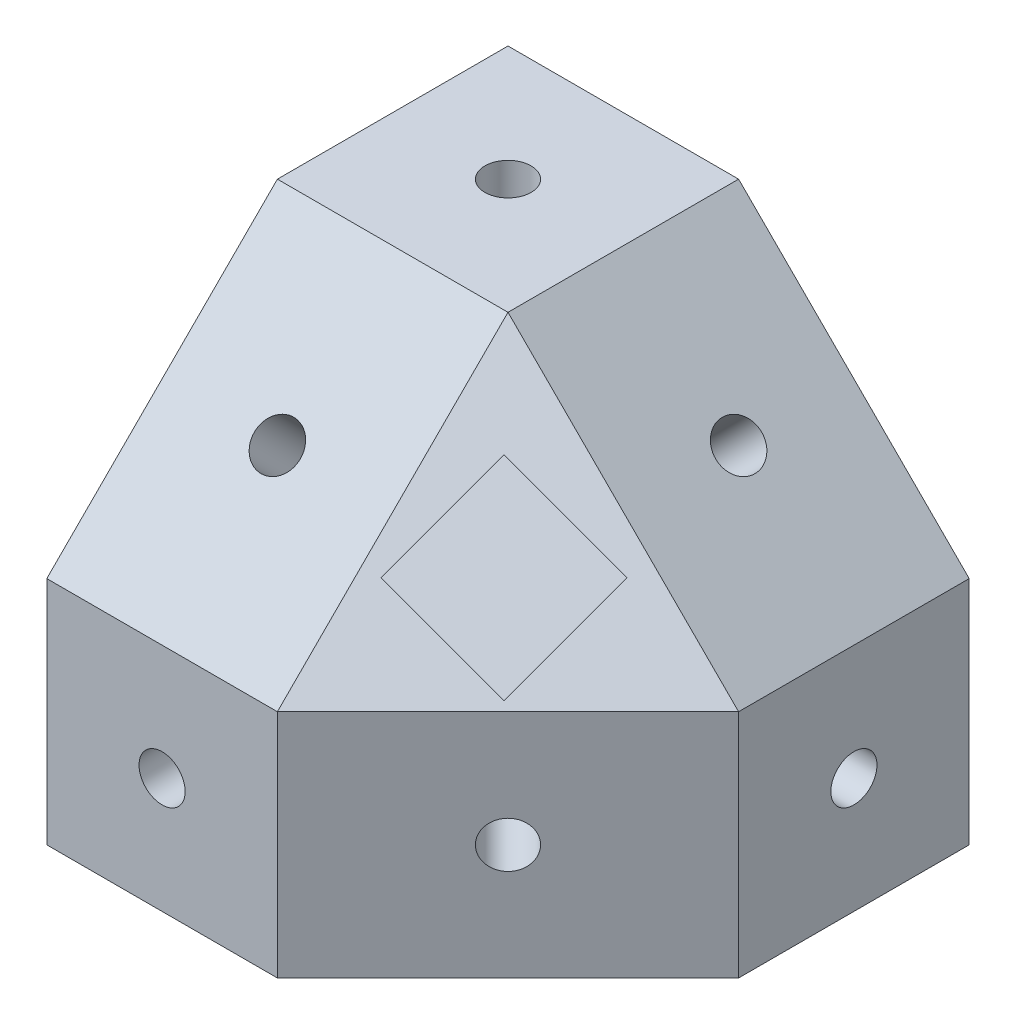
from build123d import *

# Parameters (mm, degrees)
SKETCH1_W           = 30
SKETCH1_H           = 30
BOSS_EXTRUDE1_DEPTH = 30
CUT_EXTRUDE1_DEPTH  = 30
CUT_EXTRUDE2_DEPTH  = 30
CUT_EXTRUDE3_DEPTH  = 30
CUT_EXTRUDE4_DEPTH  = 30
CUT_EXTRUDE5_DEPTH  = 15
SKETCH6_R           = 1.5
CUT_EXTRUDE6_DEPTH  = 10
SKETCH7_R           = 1.5
CUT_EXTRUDE7_DEPTH  = 10
SKETCH8_R           = 1.5
CUT_EXTRUDE8_DEPTH  = 10
SKETCH9_R           = 1.5
CUT_EXTRUDE9_DEPTH  = 10
SKETCH10_R          = 1.5
CUT_EXTRUDE10_DEPTH = 10
SKETCH11_R          = 1.5
CUT_EXTRUDE11_DEPTH = 10


with BuildPart() as part:
    # Sketch1 → Boss-Extrude1 (new body)
    with BuildSketch(Plane.XY):
        with Locations((15, 15)):
            Rectangle(SKETCH1_W, SKETCH1_H)
    extrude(amount=-BOSS_EXTRUDE1_DEPTH)

    # Sketch2 → Cut-Extrude1 (cut)
    with BuildSketch(Plane.XY):
        Polygon((15, 30), (30, 15), (45, 15), (45, 45.619084343), (15, 40.368332998), align=None)
    extrude(amount=-CUT_EXTRUDE1_DEPTH, mode=Mode.SUBTRACT)

    # Sketch3 → Cut-Extrude2 (cut)
    with BuildSketch(Plane.ZY):
        Polygon((0, 15), (-15, 30), (-15, 36.177250049), (9.539630377, 36.177250049), (9.539630377, 15), align=None)
    extrude(amount=-CUT_EXTRUDE2_DEPTH, mode=Mode.SUBTRACT)

    # Sketch4 → Cut-Extrude3 (cut)
    with BuildSketch(Plane.XZ):
        Polygon((15, 0), (30, -15), (40.227840819, -15), (40.227840819, 9.317096887), (15, 8.966367386), align=None)
    extrude(amount=-CUT_EXTRUDE3_DEPTH, mode=Mode.SUBTRACT)

    # 3DSketch1 → Cut-Extrude4 (cut)
    with BuildSketch(Plane(origin=(33.996909354, 3.570047518, -7.566956872), x_dir=(-0.34464530014522, 0.4926249601560642, 0.7990871452595439), z_dir=(-0.2113248654051872, 0.788675134594813, -0.5773502691896257))):
        Polygon((0, 0), (25.47550653, -16.637081723), (36.340550094, 0), (10.865043564, 16.637081723), align=None)
    extrude(amount=CUT_EXTRUDE4_DEPTH, mode=Mode.SUBTRACT)

    # Sketch5 → Cut-Extrude5 (cut)
    with BuildSketch(Plane(origin=(10, 10, 10), x_dir=(0.4082482904638628, 0.40824829046386263, -0.8164965809277264), z_dir=(0.5773502691896263, 0.5773502691896258, 0.5773502691896254))):
        Polygon((19.457058725, 2.946852636), (27.184465336, 5.017404997), (29.255017696, -2.710001614), (21.527611086, -4.780553975), align=None)
    extrude(amount=-CUT_EXTRUDE5_DEPTH, mode=Mode.SUBTRACT)

    # Sketch6 → Cut-Extrude6 (cut)
    with BuildSketch(Plane(origin=(0, 30, 0), x_dir=(1, 0, 0), z_dir=(0, 1, 0))):
        with Locations(Location((7.5, 22.5, 0), (0, 0, 270))):
            Circle(SKETCH6_R)
    extrude(amount=-CUT_EXTRUDE6_DEPTH, mode=Mode.SUBTRACT)

    # Sketch7 → Cut-Extrude7 (cut)
    with BuildSketch(Plane(origin=(0, 7.5, 7.5), x_dir=(1, 0, 0), z_dir=(0, 0.7071067811865477, 0.7071067811865475))):
        with Locations(Location((7.5, 21.213203436, 0), (0, 0, 270))):
            Circle(SKETCH7_R)
    extrude(amount=-CUT_EXTRUDE7_DEPTH, mode=Mode.SUBTRACT)

    # Sketch8 → Cut-Extrude8 (cut)
    with BuildSketch(Plane.XY):
        with Locations((7.5, 7.5)):
            Circle(SKETCH8_R)
    extrude(amount=-CUT_EXTRUDE8_DEPTH, mode=Mode.SUBTRACT)

    # Sketch9 → Cut-Extrude9 (cut)
    with BuildSketch(Plane(origin=(22.5, 22.5, 0), x_dir=(0, 0, -1), z_dir=(0.7071067811865474, 0.7071067811865477, 0))):
        with Locations(Location((22.5, -0.001601718, 0), (0, 0, 90))):
            Circle(SKETCH9_R)
    extrude(amount=-CUT_EXTRUDE9_DEPTH, mode=Mode.SUBTRACT)

    # Sketch10 → Cut-Extrude10 (cut)
    with BuildSketch(Plane(origin=(30, 0, 0), x_dir=(0, 0, -1), z_dir=(1, 0, 0))):
        with Locations(Location((22.5, 7.5, 0), (0, 0, 90))):
            Circle(SKETCH10_R)
    extrude(amount=-CUT_EXTRUDE10_DEPTH, mode=Mode.SUBTRACT)

    # Sketch11 → Cut-Extrude11 (cut)
    with BuildSketch(Plane(origin=(7.5, 0, 7.5), x_dir=(0.7071067811865475, 0, -0.7071067811865477), z_dir=(0.7071067811865477, 0, 0.7071067811865475))):
        with Locations((21.211601718, 7.5)):
            Circle(SKETCH11_R)
    extrude(amount=-CUT_EXTRUDE11_DEPTH, mode=Mode.SUBTRACT)


solid = part.part
